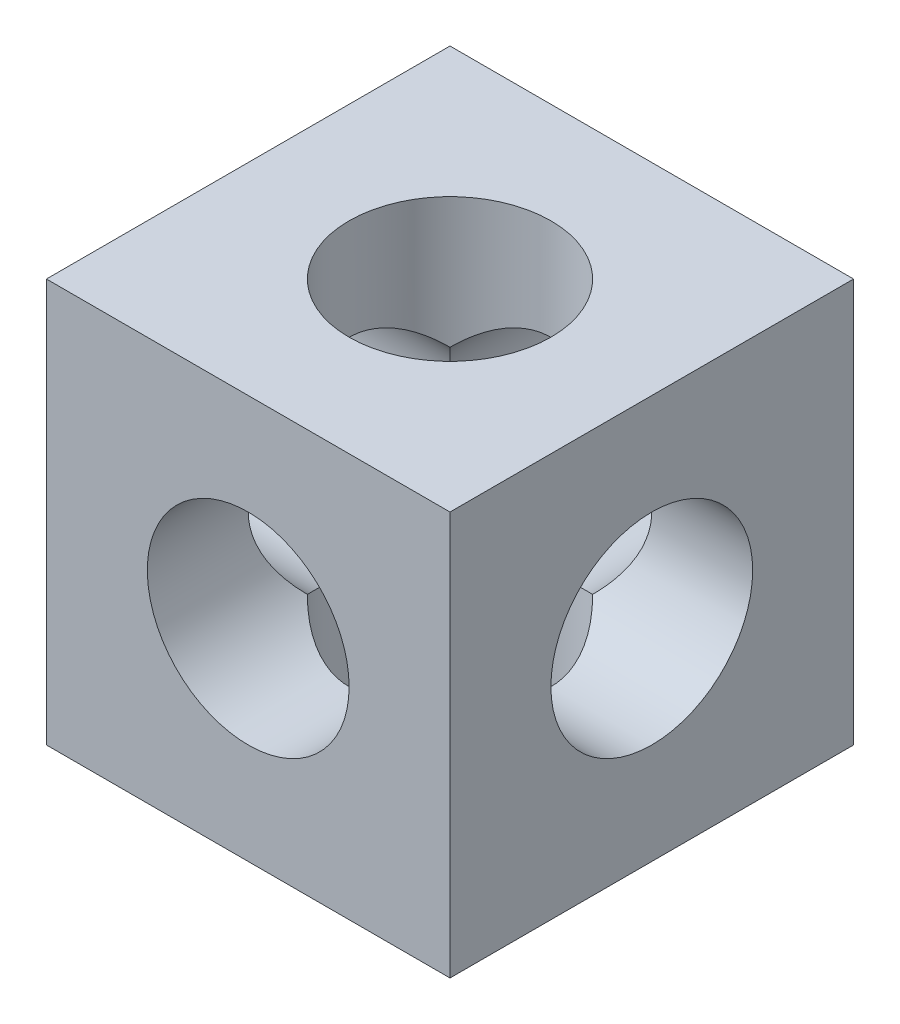
from build123d import *

# Parameters (mm, degrees)
SKETCH_1_W          = 6
SKETCH_1_H          = 6
EXTRUDE_1_DEPTH     = 3
SKETCH_2_R          = 1.5
CUT_EXTRUDE_1_DEPTH = 8
SKETCH_3_R          = 1.5
CUT_EXTRUDE_2_DEPTH = 8
SKETCH_4_R          = 1.5
CUT_EXTRUDE_3_DEPTH = 8


with BuildPart() as part:
    # 草图1 → 凸台-拉伸1 (new, symmetric)
    with BuildSketch(Plane.XY):
        Rectangle(SKETCH_1_W, SKETCH_1_H)
    extrude(amount=EXTRUDE_1_DEPTH, both=True)

    # 草图2 → 切除-拉伸1 (cut)
    with BuildSketch(Plane.ZY.offset(3)):
        with Locations(Location((0, 0, 0), (0, 0, 270))):
            Circle(SKETCH_2_R)
    extrude(amount=-CUT_EXTRUDE_1_DEPTH, mode=Mode.SUBTRACT)

    # 草图3 → 切除-拉伸2 (cut)
    with BuildSketch(Plane(origin=(0, 3, 0), x_dir=(1, 0, 0), z_dir=(0, 1, 0))):
        with Locations(Location((0, 0, 0), (0, 0, 270))):
            Circle(SKETCH_3_R)
    extrude(amount=-CUT_EXTRUDE_2_DEPTH, mode=Mode.SUBTRACT)

    # 草图4 → 切除-拉伸3 (cut)
    with BuildSketch(Plane(origin=(0, 0, -3), x_dir=(-1, 0, 0), z_dir=(0, 0, -1))):
        with Locations(Location((0, 0, 0), (0, 0, 45))):
            Circle(SKETCH_4_R)
    extrude(amount=-CUT_EXTRUDE_3_DEPTH, mode=Mode.SUBTRACT)


solid = part.part
